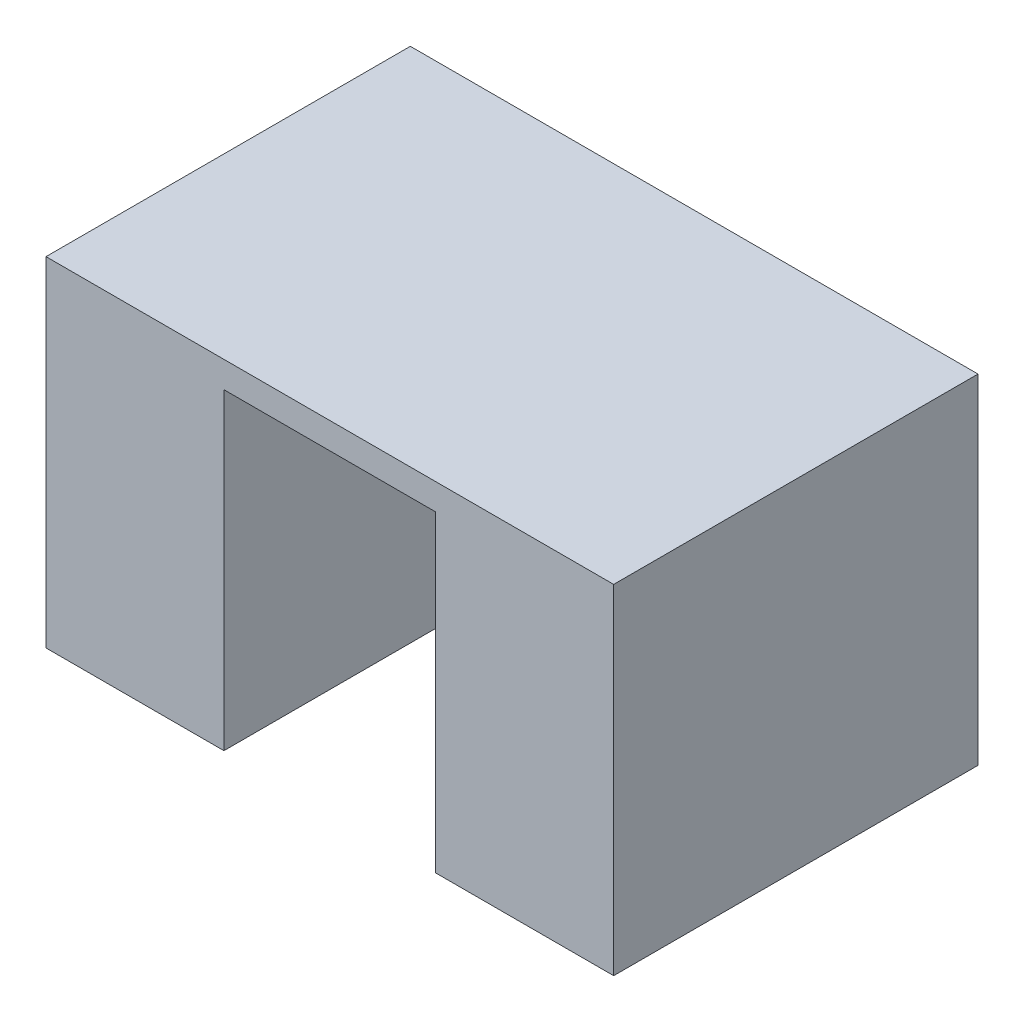
from build123d import *

# Parameters (mm, degrees)
SKETCH1_W           = 67
SKETCH1_H           = 43
BOSS_EXTRUDE1_DEPTH = 40
SKETCH1_3_W         = 25
SKETCH1_3_H         = 43
CUT_EXTRUDE1_DEPTH  = 36.9


with BuildPart() as part:
    # Sketch1 → Boss-Extrude1 (new body)
    with BuildSketch(Plane(origin=(0, 0, 0), x_dir=(-1, 0, 0), z_dir=(0, 1, 0))):
        with Locations((33.5, -14)):
            Rectangle(SKETCH1_W, SKETCH1_H)
    extrude(amount=BOSS_EXTRUDE1_DEPTH)

    # Sketch1<3> → Cut-Extrude1 (cut)
    with BuildSketch(Plane(origin=(0, 0, 0), x_dir=(-1, 0, 0), z_dir=(0, 1, 0))):
        with Locations((33.5, -14)):
            Rectangle(SKETCH1_3_W, SKETCH1_3_H)
    extrude(amount=CUT_EXTRUDE1_DEPTH, mode=Mode.SUBTRACT)


solid = part.part
